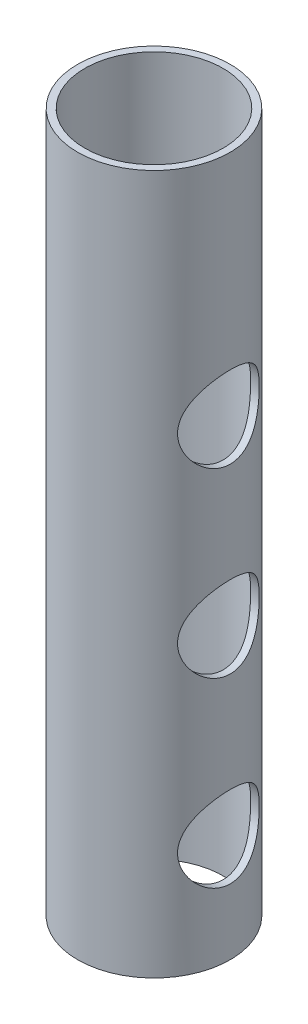
from build123d import *

# Parameters (mm, degrees)
SKETCH1_R           = 21.53
SKETCH1_R_2         = 19.53
BOSS_EXTRUDE1_DEPTH = 197.41
SKETCH2_R           = 11.53
CUT_EXTRUDE1_DEPTH  = 200.744311308


with BuildPart() as part:
    # Sketch1 → Boss-Extrude1 (new body)
    with BuildSketch(Plane(origin=(0, 0, 0), x_dir=(1, 0, 0), z_dir=(0, 1, 0))):
        with Locations(Location((0, 0, 0), (0, 0, 270))):
            Circle(SKETCH1_R)
        with Locations(Location((0, 0, 0), (0, 0, 270))):
            Circle(SKETCH1_R_2, mode=Mode.SUBTRACT)
    extrude(amount=BOSS_EXTRUDE1_DEPTH)

    # Sketch2 → Cut-Extrude1 (cut, through all)
    with BuildSketch(Plane(origin=(0, 0, 0), x_dir=(0, 0, -1), z_dir=(1, 0, 0))):
        with Locations(Location((0, 132.71, 0), (0, 0, 180))):
            Circle(SKETCH2_R)
        with Locations(Location((0, 81.41, 0), (0, 0, 180))):
            Circle(SKETCH2_R)
        with Locations(Location((0, 30.11, 0), (0, 0, 180))):
            Circle(SKETCH2_R)
    extrude(amount=CUT_EXTRUDE1_DEPTH, mode=Mode.SUBTRACT)


solid = part.part
